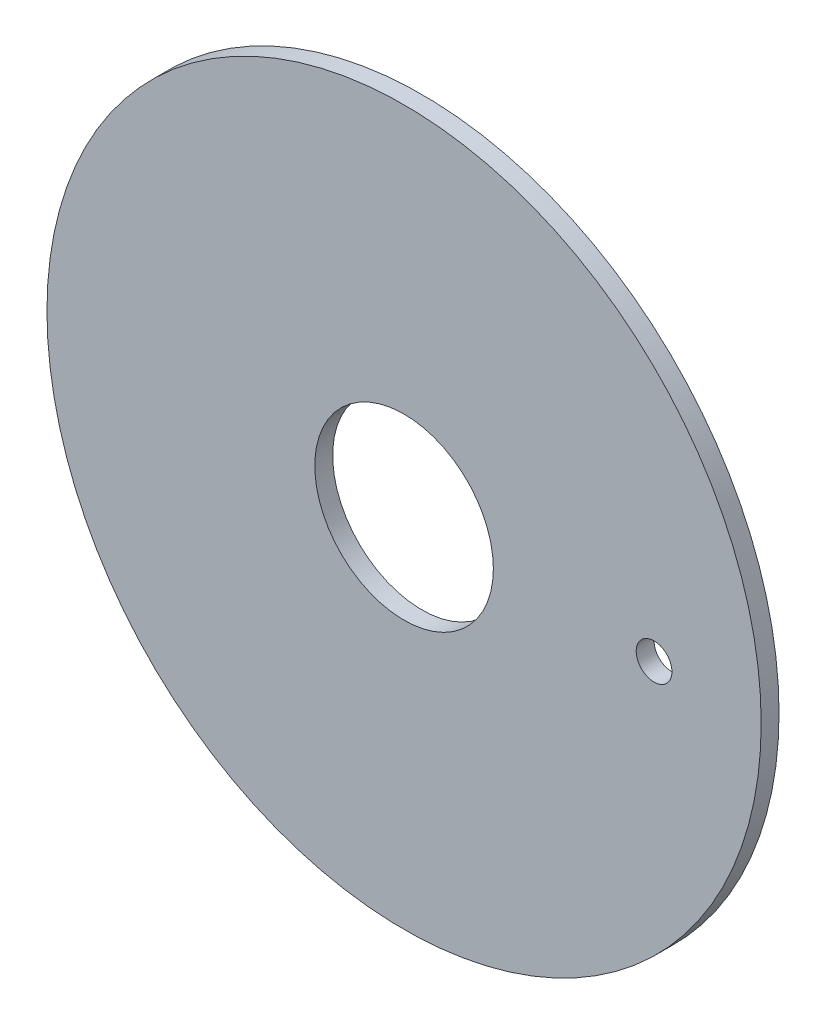
from build123d import *

# Parameters (mm, degrees)
SKETCH1_R           = 100
SKETCH1_R_2         = 25
SKETCH1_R_3         = 5
BOSS_EXTRUDE1_DEPTH = 5


with BuildPart() as part:
    # Sketch1 → Boss-Extrude1 (new body)
    with BuildSketch(Plane.XY):
        Circle(SKETCH1_R)
        Circle(SKETCH1_R_2, mode=Mode.SUBTRACT)
        with Locations((70, 0)):
            Circle(SKETCH1_R_3, mode=Mode.SUBTRACT)
    extrude(amount=BOSS_EXTRUDE1_DEPTH)


solid = part.part
